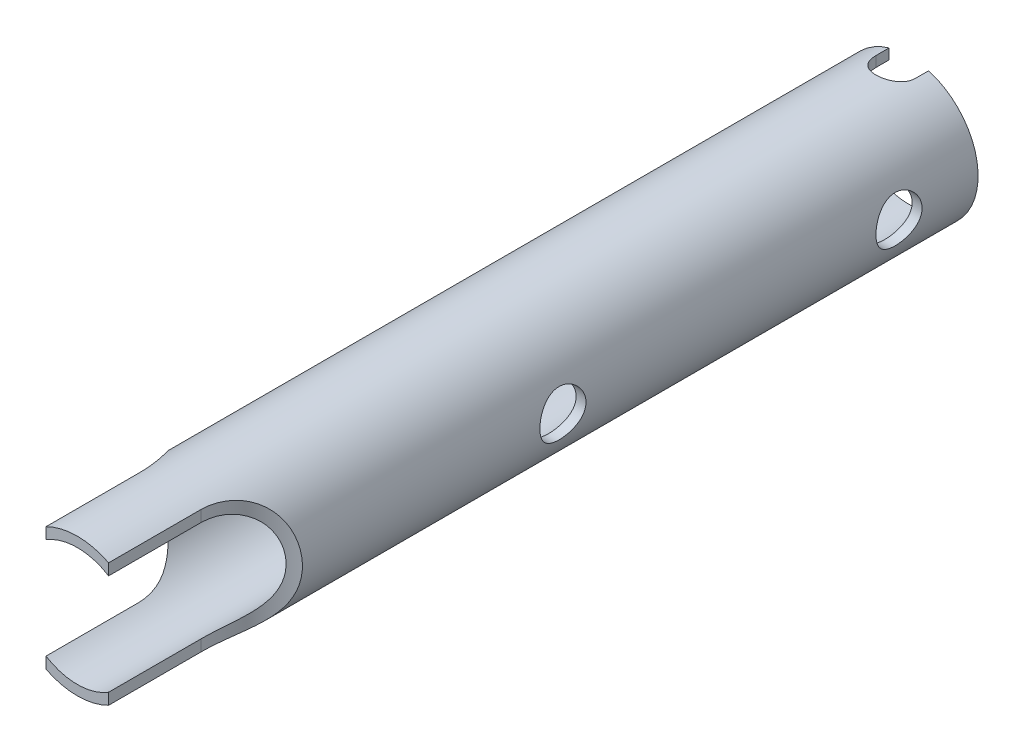
from build123d import *

# Parameters (mm, degrees)
SKETCH_1_R               = 10.5
SKETCH_1_R_2             = 9
EXTRUDE_1_DEPTH          = 100.2
CUT_EXTRUDE_2_DEPTH      = 160
CUT_EXTRUDE_3_DEPTH      = 102.294323751
CUT_EXTRUDE_3_DEPTH_BACK = 102.294323751
SKETCH_3_R               = 3.5
SKETCH_4_R               = 10.5
SKETCH_4_R_2             = 9
EXTRUDE_2_DEPTH          = 26
CUT_EXTRUDE_4_DEPTH      = 128.070610408
CUT_EXTRUDE_4_DEPTH_BACK = 128.070610408
SKETCH_5_R               = 32
CUT_EXTRUDE_5_DEPTH      = 128.070610408
CUT_EXTRUDE_5_DEPTH_BACK = 128.070610408


with BuildPart() as part:
    # 草图1 → 凸台-拉伸1 (new body)
    with BuildSketch(Plane.XY):
        Circle(SKETCH_1_R)
        Circle(SKETCH_1_R_2, mode=Mode.SUBTRACT)
    extrude(amount=EXTRUDE_1_DEPTH)

    # 草图2 → 切除-拉伸2 (cut)
    with BuildSketch(Plane(origin=(0, 0, 0), x_dir=(1, 0, 0), z_dir=(0, 1, 0))):
        with BuildLine():
            Line((-3, 2), (3, 2))
            Line((3, 2), (3, -2))
            ThreePointArc((3, -2), (0, -5), (-3, -2))
            Line((-3, -2), (-3, 2))
        make_face()
    extrude(amount=CUT_EXTRUDE_2_DEPTH, mode=Mode.SUBTRACT)

    # 草图3 → 切除-拉伸3 (cut, two sides: drawn at the far end of the back side and taken through both)
    with BuildSketch(Plane(origin=(0, 0, 0), x_dir=(0, 0, -1), z_dir=(1, 0, 0)).offset(-CUT_EXTRUDE_3_DEPTH_BACK)):
        with Locations((-12, 0)):
            Circle(SKETCH_3_R)
        with Locations((-63, 0)):
            Circle(SKETCH_3_R)
    extrude(amount=CUT_EXTRUDE_3_DEPTH + CUT_EXTRUDE_3_DEPTH_BACK, mode=Mode.SUBTRACT)

    # 草图4 → 凸台-拉伸2 (add)
    with BuildSketch(Plane.XY.offset(100.2)):
        with Locations(Location((0, 0, 0), (0, 0, 106.601549599))):
            Circle(SKETCH_4_R)
        with Locations(Location((0, 0, 0), (0, 0, 109.471220634))):
            Circle(SKETCH_4_R_2, mode=Mode.SUBTRACT)
    extrude(amount=EXTRUDE_2_DEPTH)

    # 草图5 → 切除-拉伸4 (cut, two sides: drawn at the far end of the back side and taken through both)
    with BuildSketch(Plane(origin=(0, 0, 0), x_dir=(1, 0, 0), z_dir=(0, 1, 0)).offset(-CUT_EXTRUDE_4_DEPTH_BACK)):
        with Locations((-36.75, -126.2)):
            Circle(SKETCH_5_R)
        with Locations((36.75, -126.2)):
            Circle(SKETCH_5_R)
    extrude(amount=CUT_EXTRUDE_4_DEPTH + CUT_EXTRUDE_4_DEPTH_BACK, mode=Mode.SUBTRACT)

    # 草图6 → 切除-拉伸5 (cut, two sides: drawn at the far end of the back side and taken through both)
    with BuildSketch(Plane(origin=(0, 0, 0), x_dir=(1, 0, 0), z_dir=(0, 1, 0)).offset(-CUT_EXTRUDE_5_DEPTH_BACK)):
        with BuildLine():
            Line((4.75, -126.2), (4.75, -112.2))
            ThreePointArc((4.75, -112.2), (7.971825407, -104.421825407), (15.75, -101.2))
            Line((15.75, -101.2), (15.75, -126.2))
            Line((15.75, -126.2), (4.75, -126.2))
        make_face()
        with BuildLine():
            Line((-15.75, -101.2), (-15.75, -126.2))
            Line((-15.75, -126.2), (-4.75, -126.2))
            Line((-4.75, -126.2), (-4.75, -112.2))
            ThreePointArc((-4.75, -112.2), (-7.971825407, -104.421825407), (-15.75, -101.2))
        make_face()
    extrude(amount=CUT_EXTRUDE_5_DEPTH + CUT_EXTRUDE_5_DEPTH_BACK, mode=Mode.SUBTRACT)


solid = part.part
